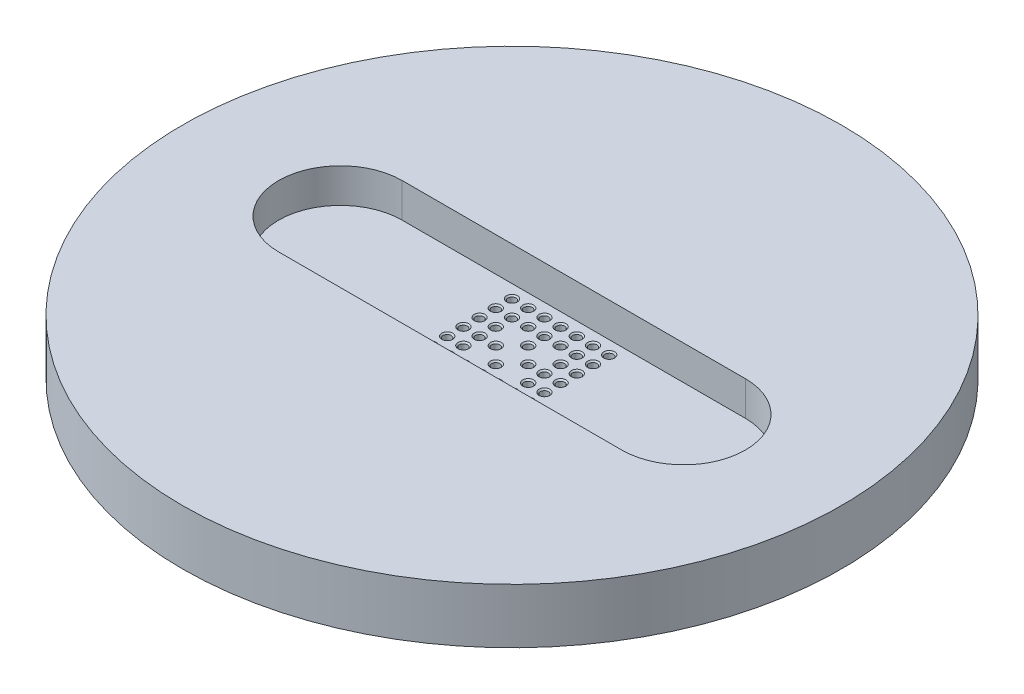
from build123d import *

# Parameters (mm, degrees)
SKETCH1_R                               = 60.96
BILLET_DEPTH                            = 10.16
KEROSENE_WELL_DEPTH                     = 6.35
FIRST_KEROSENE_OUTLET_REACH             = 88.807
SKETCH4_R                               = 0.7493
BOTTOM_NEEDLE_CHAMFER_SIZE              = 0.254
LPATTERN1_COUNT                         = 7
LPATTERN1_PITCH                         = 2.9972
LPATTERN1_COUNT_DIR2                    = 7
LPATTERN1_PITCH_DIR2                    = 2.9972
BOTTOM_NEEDLE_CHAMFER_OF_LPATTERN1_SIZE = 0.254


with BuildPart() as part:
    # Sketch1 → Billet (new body)
    with BuildSketch(Plane(origin=(0, 0, 0), x_dir=(1, 0, 0), z_dir=(0, 1, 0))):
        Circle(SKETCH1_R)
    extrude(amount=-BILLET_DEPTH)

    # Sketch2 → Kerosene Well (cut)
    with BuildSketch(Plane(origin=(0, 0, 0), x_dir=(1, 0, 0), z_dir=(0, 1, 0))):
        with BuildLine():
            Line((-31.75, 11.43), (31.75, 11.43))
            ThreePointArc((31.75, 11.43), (43.18, 0), (31.75, -11.43))
            Line((31.75, -11.43), (-31.75, -11.43))
            ThreePointArc((-31.75, -11.43), (-43.18, 0), (-31.75, 11.43))
        make_face()
    extrude(amount=-KEROSENE_WELL_DEPTH, mode=Mode.SUBTRACT)

    # Sketch4 → First Kerosene Outlet (cut, up to next)
    with BuildSketch(Plane(origin=(0, -10.16, 0), x_dir=(1, 0, 0), z_dir=(0, 1, 0)), mode=Mode.PRIVATE) as first_kerosene_outlet_sk1:
        with Locations((8.9916, 8.9916)):
            Circle(SKETCH4_R)
    first_kerosene_outlet_tool1 = extrude(first_kerosene_outlet_sk1.sketch, amount=FIRST_KEROSENE_OUTLET_REACH, mode=Mode.PRIVATE) & part.part
    first_kerosene_outlet = first_kerosene_outlet_tool1.solids().sort_by_distance((8.9916, -10.16, -8.9916))[0]
    add(first_kerosene_outlet, mode=Mode.SUBTRACT)

    # Bottom Needle Chamfer
    bottom_needle_chamfer_edges = [part.edges().sort_by_distance(p)[0] for p in [
        (8.2423, -6.35, -8.9916),
    ]]
    chamfer(bottom_needle_chamfer_edges, length=BOTTOM_NEEDLE_CHAMFER_SIZE)

    # LPattern1: First Kerosene Outlet 7 × 7, 5 skipped
    with Locations(*[(-j * LPATTERN1_PITCH_DIR2, 0, i * LPATTERN1_PITCH) for i in range(LPATTERN1_COUNT) for j in range(LPATTERN1_COUNT_DIR2) if (i, j) not in ((0, 0), (2, 2), (2, 4), (3, 3), (4, 2), (4, 4))]):
        add(first_kerosene_outlet, mode=Mode.SUBTRACT)

    # Bottom Needle Chamfer of LPattern1
    bottom_needle_chamfer_of_lpattern1_edges = [part.edges().sort_by_distance(p)[0] for p in [
        (5.2451, -6.35, -8.9916),
        (2.2479, -6.35, -8.9916),
        (-0.7493, -6.35, -8.9916),
        (-3.7465, -6.35, -8.9916),
        (-6.7437, -6.35, -8.9916),
        (-9.7409, -6.35, -8.9916),
        (8.2423, -6.35, -5.9944),
        (5.2451, -6.35, -5.9944),
        (2.2479, -6.35, -5.9944),
        (-0.7493, -6.35, -5.9944),
        (-3.7465, -6.35, -5.9944),
        (-6.7437, -6.35, -5.9944),
        (-9.7409, -6.35, -5.9944),
        (8.2423, -6.35, -2.9972),
        (5.2451, -6.35, -2.9972),
        (-0.7493, -6.35, -2.9972),
        (-6.7437, -6.35, -2.9972),
        (-9.7409, -6.35, -2.9972),
        (8.2423, -6.35, 0),
        (5.2451, -6.35, 0),
        (2.2479, -6.35, 0),
        (-3.7465, -6.35, 0),
        (-6.7437, -6.35, 0),
        (-9.7409, -6.35, 0),
        (8.2423, -6.35, 2.9972),
        (5.2451, -6.35, 2.9972),
        (-0.7493, -6.35, 2.9972),
        (-6.7437, -6.35, 2.9972),
        (-9.7409, -6.35, 2.9972),
        (8.2423, -6.35, 5.9944),
        (5.2451, -6.35, 5.9944),
        (2.2479, -6.35, 5.9944),
        (-0.7493, -6.35, 5.9944),
        (-3.7465, -6.35, 5.9944),
        (-6.7437, -6.35, 5.9944),
        (-9.7409, -6.35, 5.9944),
        (8.2423, -6.35, 8.9916),
        (5.2451, -6.35, 8.9916),
        (2.2479, -6.35, 8.9916),
        (-0.7493, -6.35, 8.9916),
        (-3.7465, -6.35, 8.9916),
        (-6.7437, -6.35, 8.9916),
        (-9.7409, -6.35, 8.9916),
    ]]
    chamfer(bottom_needle_chamfer_of_lpattern1_edges, length=BOTTOM_NEEDLE_CHAMFER_OF_LPATTERN1_SIZE)


solid = part.part
